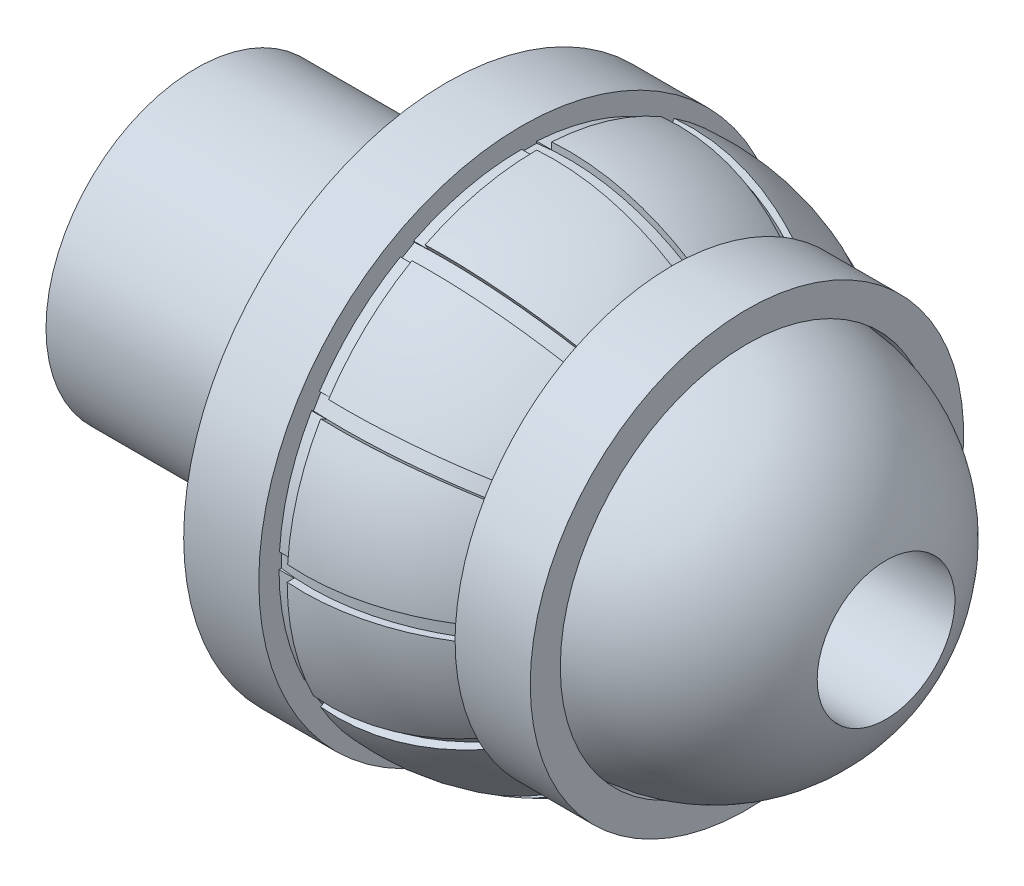
from build123d import *

# Parameters (mm, degrees)
ENL_V_MAT_EXTRU_2_DEPTH      = 1
R_P_TITION_CIRCULAIRE1_COUNT = 12
ESQUISSE9_R                  = 16.652952846
ESQUISSE9_R_2                = 16.152952846
ENL_V_MAT_EXTRU_3_DEPTH      = 1
ECHELLE3_SCALE               = 0.6
ESQUISSE12_R                 = 6
BOSS_EXTRU_2_DEPTH           = 10
ESQUISSE13_R                 = 2.75
ENL_V_MAT_EXTRU_5_DEPTH      = 32.69773054


with BuildPart() as part:
    # Esquisse3 → Révolution3 (revolve)
    with BuildSketch(Plane.XY, mode=Mode.PRIVATE) as r_volution3_sk:
        with BuildLine():
            Line((5, 17.5), (5, 16.5))
            ThreePointArc((5, 16.5), (10.181885267, 16.340581134), (15, 14.426653308))
            Line((15, 14.426653308), (20, 14.426653308))
            Line((20, 14.426653308), (20, 12.426653308))
            Line((20, 12.426653308), (18, 12.426653308))
            ThreePointArc((18, 12.426653308), (26.637443378, 8.760216774), (30, 0))
            Line((30, 0), (0, 0))
            Line((0, 0), (0, 17.5))
            Line((0, 17.5), (5, 17.5))
        make_face()
    revolve(r_volution3_sk.sketch.rotate(Axis((-14.762690298, 0, 0), (1, 0, 0)), 90), axis=Axis((-14.762690298, 0, 0), (1, 0, 0)))

    # Esquisse8 → Enlèv. mat.-Extru.2 (cut)
    with BuildSketch(Plane(origin=(0, 0, 0), x_dir=(1, 0, 0), z_dir=(0, 1, 0))):
        with BuildLine():
            Line((5, 16.5), (5, 16))
            ThreePointArc((5, 16), (10.181885267, 15.840581134), (15, 13.926653308))
            Line((15, 13.926653308), (15, 14.426653308))
            ThreePointArc((15, 14.426653308), (10.181885267, 16.340581134), (5, 16.5))
        make_face()
    enl_v_mat_extru_2 = extrude(amount=-ENL_V_MAT_EXTRU_2_DEPTH, mode=Mode.SUBTRACT)

    # Répétition circulaire1: Enlèv. mat.-Extru.2 ×12 about axis
    r_p_tition_circulaire1_axis = Axis((0, 0, 0), (1, 0, 0))
    for i in range(1, R_P_TITION_CIRCULAIRE1_COUNT):
        add(enl_v_mat_extru_2.rotate(r_p_tition_circulaire1_axis, i * 360 / R_P_TITION_CIRCULAIRE1_COUNT), mode=Mode.SUBTRACT)

    # Esquisse9 → Enlèv. mat.-Extru.3 (cut)
    with BuildSketch(Plane(origin=(5, 0, 0), x_dir=(0, 0, -1), z_dir=(1, 0, 0))):
        Circle(ESQUISSE9_R)
        Circle(ESQUISSE9_R_2, mode=Mode.SUBTRACT)
    extrude(amount=ENL_V_MAT_EXTRU_3_DEPTH, mode=Mode.SUBTRACT)


with BuildPart() as part_1:
    # Echelle3: scaled about (0, 0, 0)
    add(part.part.scale(ECHELLE3_SCALE))

    # Esquisse12 → Boss.-Extru.2 (add)
    with BuildSketch(Plane.ZY):
        with Locations(Location((0, 0, 0), (0, 0, 180))):
            Circle(ESQUISSE12_R)
    extrude(amount=BOSS_EXTRU_2_DEPTH)

    # Esquisse13 → Enlèv. mat.-Extru.5 (cut, through all)
    with BuildSketch(Plane.ZY.offset(10)):
        Circle(ESQUISSE13_R)
    extrude(amount=-ENL_V_MAT_EXTRU_5_DEPTH, mode=Mode.SUBTRACT)


solid = part_1.part
